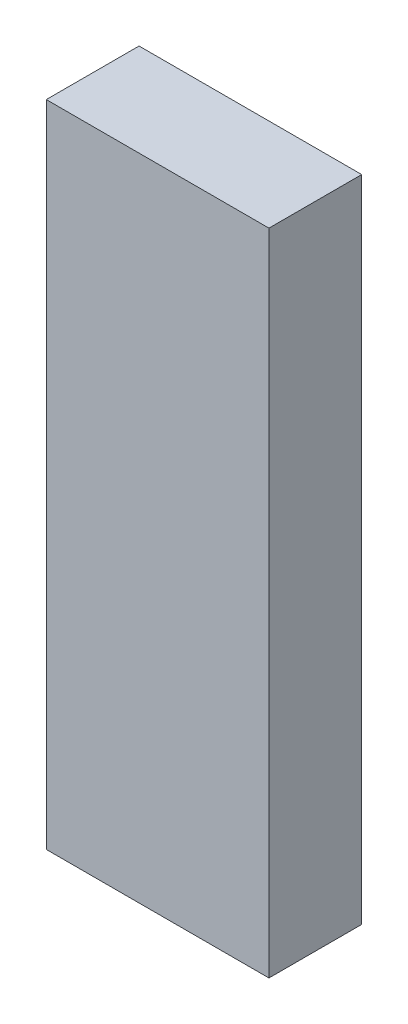
from build123d import *

# Parameters (mm, degrees)
SKETCH1_W           = 12
SKETCH1_H           = 35
BOSS_EXTRUDE1_DEPTH = 5


with BuildPart() as part:
    # Sketch1 → Boss-Extrude1 (new body)
    with BuildSketch(Plane.XY):
        Rectangle(SKETCH1_W, SKETCH1_H)
    extrude(amount=BOSS_EXTRUDE1_DEPTH)


solid = part.part
